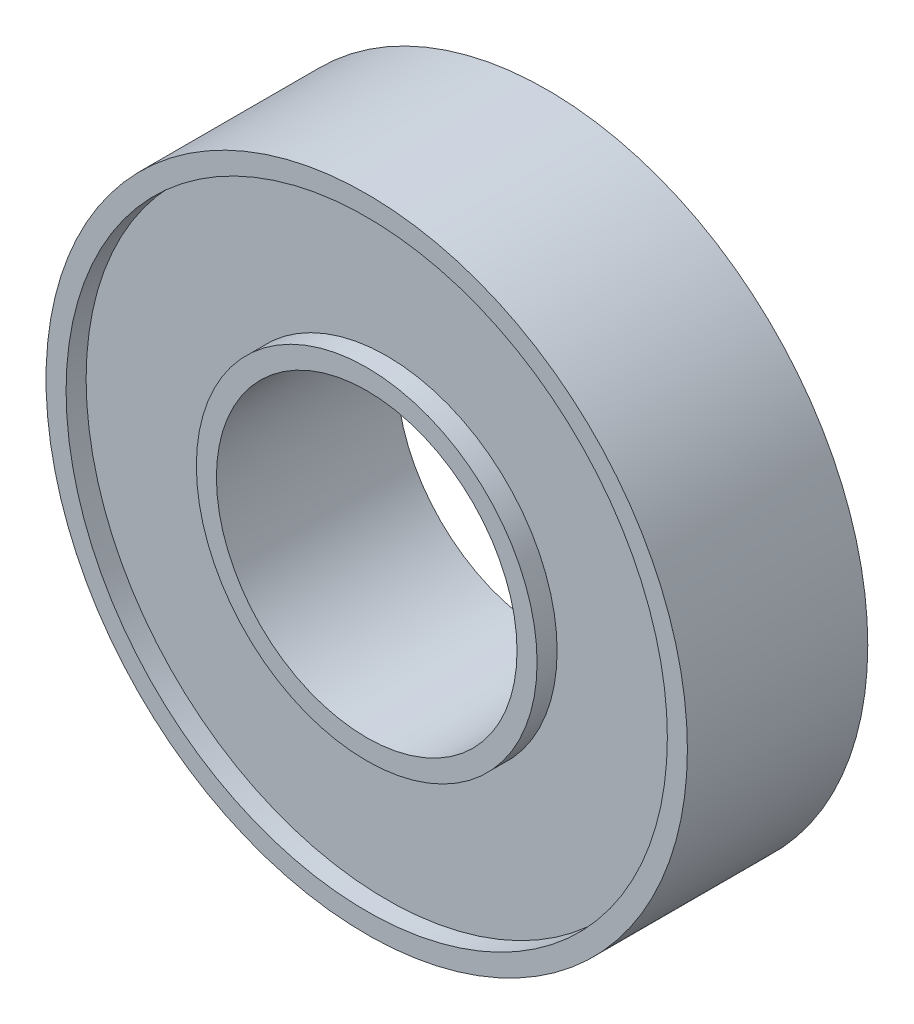
from build123d import *


with BuildPart() as part:
    # Sketch4 → Revolve3 (revolve)
    with BuildSketch(Plane(origin=(0, 0, 0), x_dir=(0, 0, -1), z_dir=(1, 0, 0)), mode=Mode.PRIVATE) as revolve3_sk:
        Polygon((-4.5, 16), (4.5, 16), (4.5, 15), (3.5, 15), (3.5, 8.5), (4.5, 8.5), (4.5, 7.5), (-4.5, 7.5), (-4.5, 8.5), (-3.5, 8.5), (-3.5, 15), (-4.5, 15), align=None)
    revolve(revolve3_sk.sketch.rotate(Axis((0, 0, 12.528924441), (0, 0, -1)), 90), axis=Axis((0, 0, 12.528924441), (0, 0, -1)))


solid = part.part
